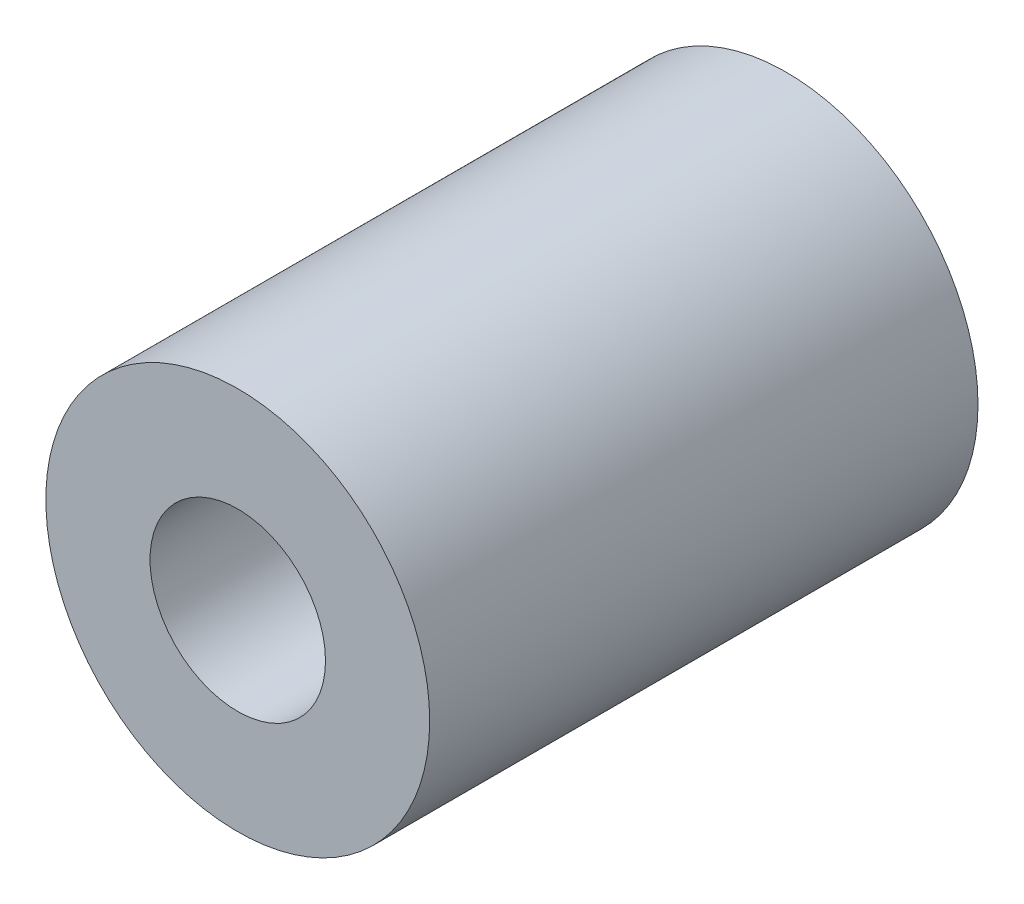
from build123d import *

# Parameters (mm, degrees)
SKETCH_1_R      = 3.5
SKETCH_1_R_2    = 1.6
EXTRUDE_1_DEPTH = 10


with BuildPart() as part:
    # ｽｹｯﾁ1 → ﾎﾞｽ - 押し出し1 (new body)
    with BuildSketch(Plane.XY):
        Circle(SKETCH_1_R)
        Circle(SKETCH_1_R_2, mode=Mode.SUBTRACT)
    extrude(amount=EXTRUDE_1_DEPTH)


solid = part.part
